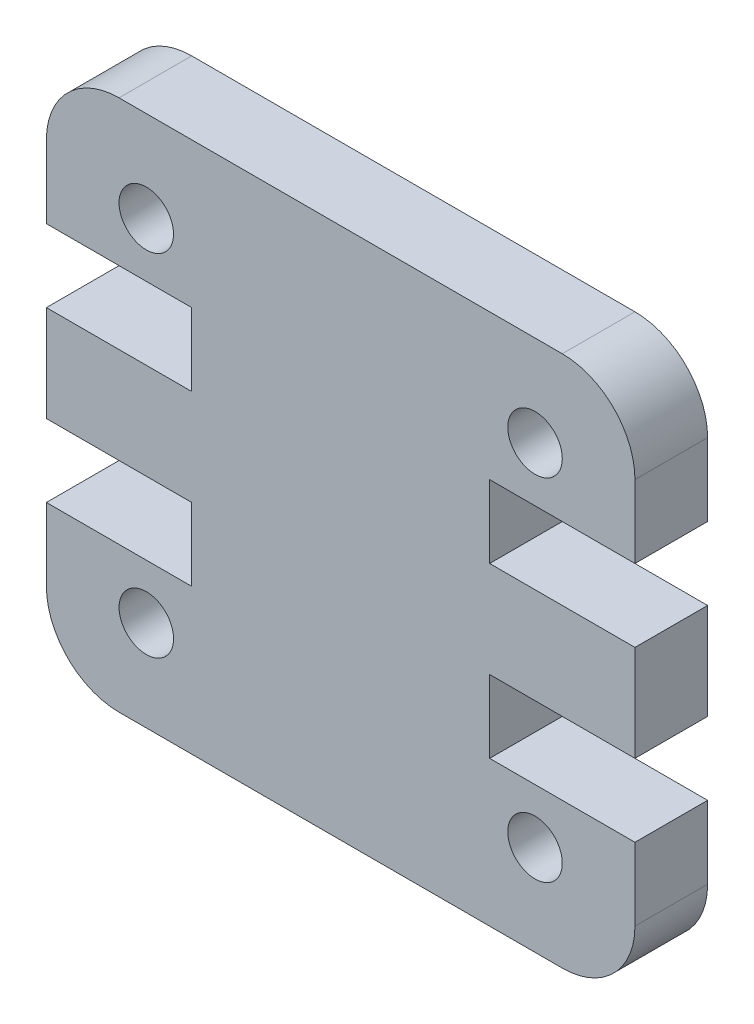
from build123d import *

# Parameters (mm, degrees)
SKETCH1_R           = 0.75
BOSS_EXTRUDE1_DEPTH = 2


with BuildPart() as part:
    # Sketch1 → Boss-Extrude1 (new body)
    with BuildSketch(Plane.XY):
        with BuildLine():
            Line((16.2, 4), (16.2, 2))
            ThreePointArc((16.2, 2), (15.614213562, 0.585786438), (14.2, 0))
            Line((14.2, 0), (2, 0))
            ThreePointArc((2, 0), (0.585786438, 0.585786438), (0, 2))
            Line((0, 2), (0, 4))
            Line((0, 4), (4, 4))
            Line((4, 4), (4, 6))
            Line((4, 6), (0, 6))
            Line((0, 6), (0, 8.645))
            Line((0, 8.645), (4, 8.645))
            Line((4, 8.645), (4, 10.645))
            Line((4, 10.645), (0, 10.645))
            Line((0, 10.645), (0, 12.645))
            ThreePointArc((0, 12.645), (0.585786438, 14.059213562), (2, 14.645))
            Line((2, 14.645), (14.2, 14.645))
            ThreePointArc((14.2, 14.645), (15.614213562, 14.059213562), (16.2, 12.645))
            Line((16.2, 12.645), (16.2, 10.645))
            Line((16.2, 10.645), (12.2, 10.645))
            Line((12.2, 10.645), (12.2, 8.645))
            Line((12.2, 8.645), (16.2, 8.645))
            Line((16.2, 8.645), (16.2, 6))
            Line((16.2, 6), (12.2, 6))
            Line((12.2, 6), (12.2, 4))
            Line((12.2, 4), (16.2, 4))
        make_face()
        with Locations(Location((13.45, 2.5, 0), (0, 0, 180))):
            Circle(SKETCH1_R, mode=Mode.SUBTRACT)
        with Locations(Location((2.75, 12.145, 0), (0, 0, 180))):
            Circle(SKETCH1_R, mode=Mode.SUBTRACT)
        with Locations((13.45, 12.145)):
            Circle(SKETCH1_R, mode=Mode.SUBTRACT)
        with Locations((2.75, 2.5)):
            Circle(SKETCH1_R, mode=Mode.SUBTRACT)
    extrude(amount=BOSS_EXTRUDE1_DEPTH)


solid = part.part
